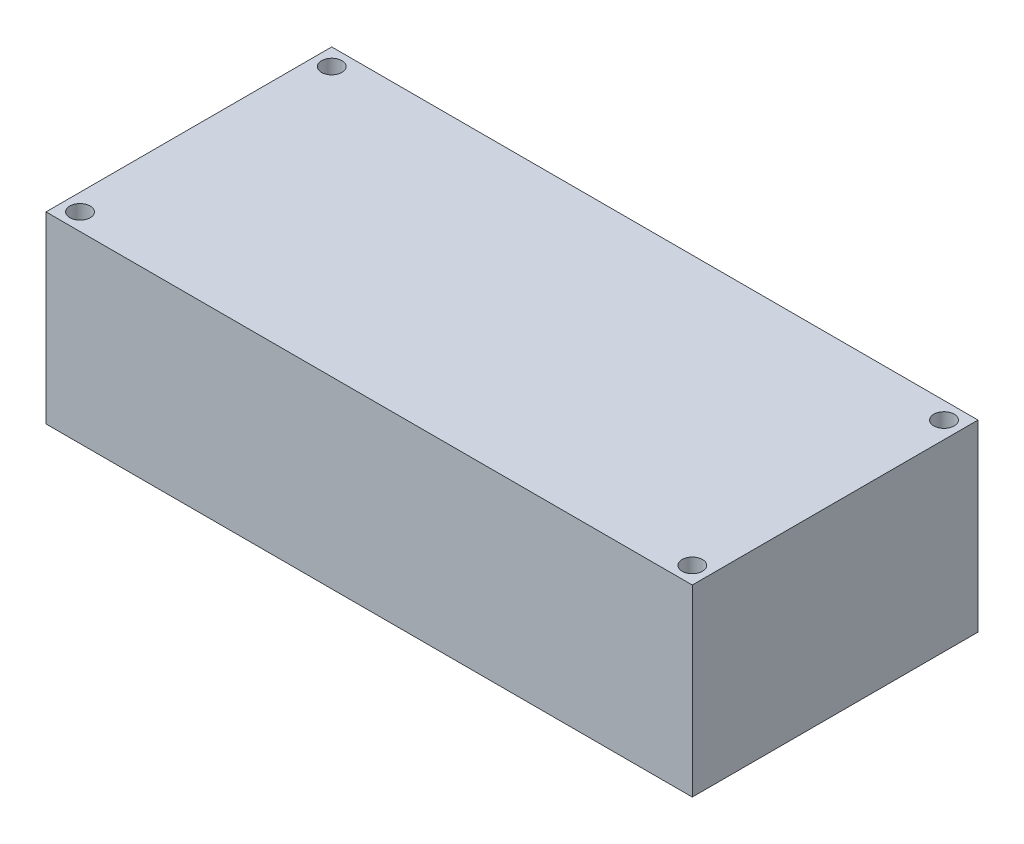
from build123d import *

# Parameters (mm, degrees)
SKETCH1_W           = 95
SKETCH1_H           = 42
SKETCH1_R           = 1.5
BOSS_EXTRUDE1_DEPTH = 27


with BuildPart() as part:
    # Sketch1 → Boss-Extrude1 (new body)
    with BuildSketch(Plane(origin=(0, 0, 0), x_dir=(1, 0, 0), z_dir=(0, 1, 0))):
        Rectangle(SKETCH1_W, SKETCH1_H)
        with Locations(Location((-45, 18.5, 0), (0, 0, 270))):
            Circle(SKETCH1_R, mode=Mode.SUBTRACT)
        with Locations(Location((-45, -18.5, 0), (0, 0, 270))):
            Circle(SKETCH1_R, mode=Mode.SUBTRACT)
        with Locations(Location((45, 18.5, 0), (0, 0, 270))):
            Circle(SKETCH1_R, mode=Mode.SUBTRACT)
        with Locations(Location((45, -18.5, 0), (0, 0, 270))):
            Circle(SKETCH1_R, mode=Mode.SUBTRACT)
    extrude(amount=BOSS_EXTRUDE1_DEPTH)


solid = part.part
